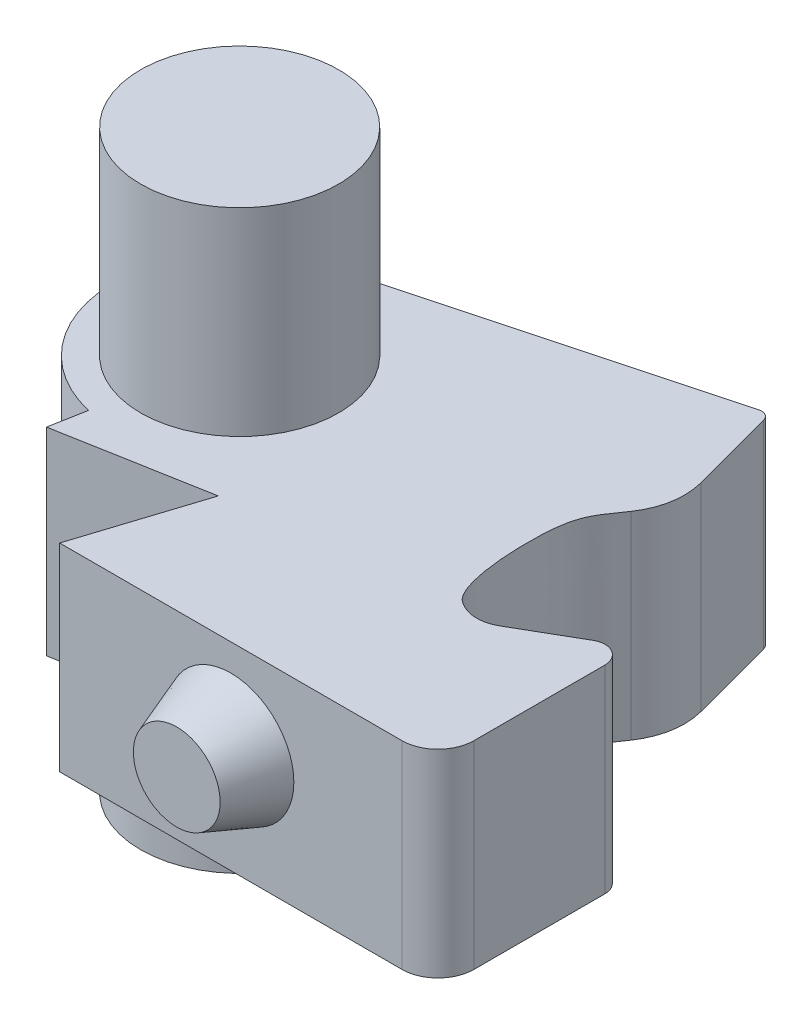
from build123d import *

# Parameters (mm, degrees)
BOSS_EXTRUDE1_DEPTH      = 2.2
BOSS_EXTRUDE2_DEPTH      = 4.4
BOSS_EXTRUDE2_DEPTH_BACK = 2
SKETCH1_3_R              = 1.1
SKETCH2_R                = 0.7
BOSS_EXTRUDE3_DEPTH      = 0.6
BOSS_EXTRUDE3_TAPER      = 20


with BuildPart() as part:
    # Sketch1 → Boss-Extrude1 (new body)
    with BuildSketch(Plane(origin=(0, 0, 0), x_dir=(1, 0, 0), z_dir=(0, 1, 0))):
        with BuildLine():
            Line((3.782845085, 1.337043166), (3.527238547, 2.290979755))
            ThreePointArc((3.527238547, 2.290979755), (3.480645964, 2.35170039), (3.404764059, 2.361690433))
            Line((3.404764059, 2.361690433), (-0.362346663, 1.352296157))
            ThreePointArc((-0.362346663, 1.352296157), (-1.399770195, -0.025365361), (-0.313114699, -1.364536253))
            Line((-0.313114699, -1.364536253), (-0.385495815, -1.757932966))
            Line((-0.385495815, -1.757932966), (1.229595775, -1.466971493))
            Line((1.229595775, -1.466971493), (0.801769877, -2.8))
            Line((0.801769877, -2.8), (4.601769877, -2.8))
            ThreePointArc((4.601769877, -2.8), (4.884612589, -2.682842712), (5.001769877, -2.4))
            Line((5.001769877, -2.4), (5.001769877, -0.946410162))
            ThreePointArc((5.001769877, -0.946410162), (4.901769877, -0.773205081), (4.701769877, -0.773205081))
            Line((4.701769877, -0.773205081), (4.041625762, -1.154339463))
            ThreePointArc((4.041625762, -1.154339463), (3.81583188, -1.20709678), (3.598705744, -1.125718327))
            add(Edge.make_bspline(
                [(3.668101763, 0.674971994), (3.507811171, 0.443176193), (3.337919583, 0.271573974), (3.416349663, -0.986324141), (3.598705744, -1.125718327)],
                knots=[0.076223888, 0.076223888, 0.076223888, 0.076223888, 0.275181008, 0.474138129, 0.474138129, 0.474138129, 0.474138129], degree=3))
            ThreePointArc((3.668101763, 0.674971994), (3.798353982, 0.993376676), (3.782845085, 1.337043166))
        make_face()
    extrude(amount=BOSS_EXTRUDE1_DEPTH)

    # Sketch1<3> → Boss-Extrude2 (add, two sides: drawn at the far end of the back side and taken through both)
    with BuildSketch(Plane(origin=(0, 0, 0), x_dir=(1, 0, 0), z_dir=(0, 1, 0)).offset(-BOSS_EXTRUDE2_DEPTH_BACK)):
        with Locations(Location((0, 0, 0), (0, 0, 270))):
            Circle(SKETCH1_3_R)
    extrude(amount=BOSS_EXTRUDE2_DEPTH + BOSS_EXTRUDE2_DEPTH_BACK)

    # Sketch2 → Boss-Extrude3 (add)
    with BuildSketch(Plane.XY.offset(2.8)):
        with Locations((2.701769877, 1.2)):
            Circle(SKETCH2_R)
    extrude(amount=BOSS_EXTRUDE3_DEPTH, taper=BOSS_EXTRUDE3_TAPER)


solid = part.part
